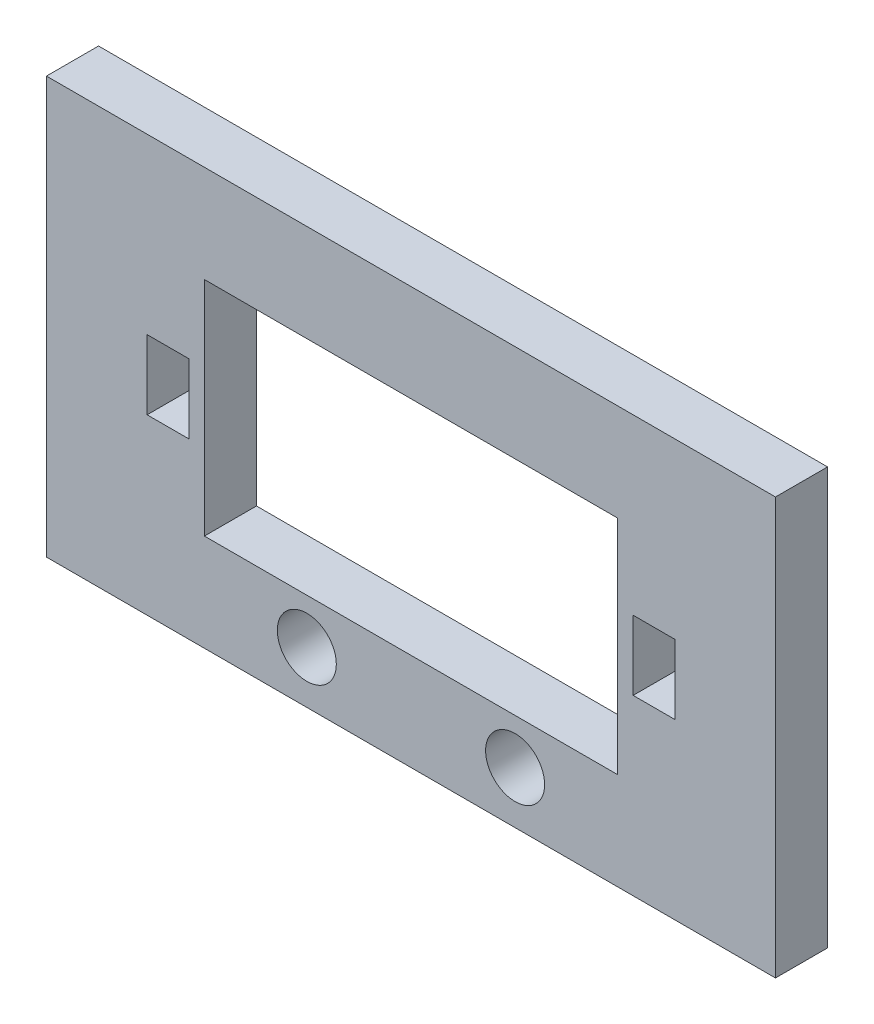
from build123d import *

# Parameters (mm, degrees)
SKETCH_1_W                             = 42
SKETCH_1_H                             = 24
SKETCH_1_W_2                           = 23.8
SKETCH_1_H_2                           = 12.8
SG90_WINDOW23P8X12P8_DEPTH             = 3
SG90_MOUNT_SLOTS_REFERENCE_DEPTH       = 25.372115214
SG90_MOUNT_SLOTS_REFERENCE_DEPTH_BACK  = 25.372115214
SKETCH_2_W                             = 2.4
SKETCH_2_H                             = 4
ADAPTER_M3_PAIR12_REFERENCE_DEPTH      = 25.372115214
ADAPTER_M3_PAIR12_REFERENCE_DEPTH_BACK = 25.372115214
SKETCH_3_R                             = 1.7


with BuildPart() as part:
    # 草图1 → SG90_window23p8x12p8 (new body)
    with BuildSketch(Plane.XY):
        Rectangle(SKETCH_1_W, SKETCH_1_H)
        Rectangle(SKETCH_1_W_2, SKETCH_1_H_2, mode=Mode.SUBTRACT)
    extrude(amount=SG90_WINDOW23P8X12P8_DEPTH)

    # 草图2 → SG90_mount_slots_REFERENCE (cut, two sides: drawn at the far end of the back side and taken through both)
    with BuildSketch(Plane.XY.offset(-SG90_MOUNT_SLOTS_REFERENCE_DEPTH_BACK)):
        with Locations((-14, 0)):
            Rectangle(SKETCH_2_W, SKETCH_2_H)
        with Locations((14, 0)):
            Rectangle(SKETCH_2_W, SKETCH_2_H)
    extrude(amount=SG90_MOUNT_SLOTS_REFERENCE_DEPTH + SG90_MOUNT_SLOTS_REFERENCE_DEPTH_BACK, mode=Mode.SUBTRACT)

    # 草图3 → Adapter_M3_pair12_REFERENCE (cut, two sides: drawn at the far end of the back side and taken through both)
    with BuildSketch(Plane.XY.offset(-ADAPTER_M3_PAIR12_REFERENCE_DEPTH_BACK)):
        with Locations((-6, -9)):
            Circle(SKETCH_3_R)
        with Locations((6, -9)):
            Circle(SKETCH_3_R)
    extrude(amount=ADAPTER_M3_PAIR12_REFERENCE_DEPTH + ADAPTER_M3_PAIR12_REFERENCE_DEPTH_BACK, mode=Mode.SUBTRACT)


solid = part.part
